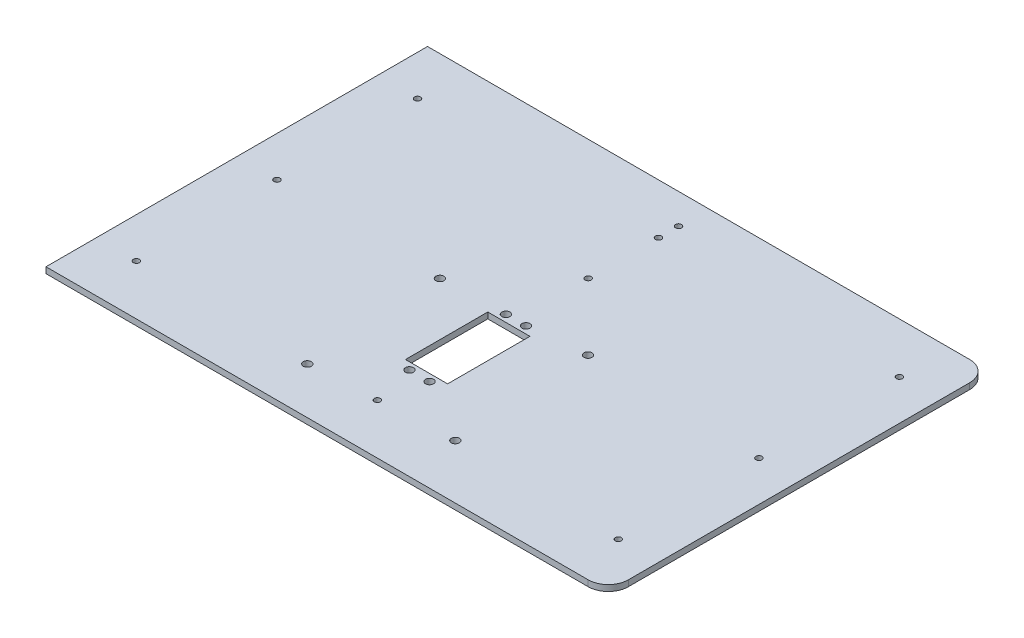
from build123d import *

# Parameters (mm, degrees)
SKETCH_1_W          = 280
SKETCH_1_H          = 190
SKETCH_1_R          = 2
SKETCH_1_W_2        = 21
SKETCH_1_H_2        = 41
EXTRUDE_1_DEPTH     = 3
FILLET_1_R          = 10
SKETCH_2_R          = 1.5
CUT_EXTRUDE_1_DEPTH = 10
SKETCH_3_R          = 1.5
CUT_EXTRUDE_2_DEPTH = 10
SKETCH_4_R          = 1.5
CUT_EXTRUDE_3_DEPTH = 10


with BuildPart() as part:
    # 草图1 → 凸台-拉伸1 (new body)
    with BuildSketch(Plane(origin=(0, 0, 0), x_dir=(1, 0, 0), z_dir=(0, 1, 0))):
        Rectangle(SKETCH_1_W, SKETCH_1_H)
        with Locations(Location((5, -1, 0), (0, 0, 270))):
            Circle(SKETCH_1_R, mode=Mode.SUBTRACT)
        with Locations(Location((-5, -1, 0), (0, 0, 270))):
            Circle(SKETCH_1_R, mode=Mode.SUBTRACT)
        with Locations(Location((-5, -49, 0), (0, 0, 270))):
            Circle(SKETCH_1_R, mode=Mode.SUBTRACT)
        with Locations(Location((-33.028134356, -71.869938174, 0), (0, 0, 270))):
            Circle(SKETCH_1_R, mode=Mode.SUBTRACT)
        with Locations(Location((5, -49, 0), (0, 0, 270))):
            Circle(SKETCH_1_R, mode=Mode.SUBTRACT)
        with Locations(Location((-36.869938174, -1.971865644, 0), (0, 0, 270))):
            Circle(SKETCH_1_R, mode=Mode.SUBTRACT)
        with Locations(Location((33.028134356, 1.869938174, 0), (0, 0, 270))):
            Circle(SKETCH_1_R, mode=Mode.SUBTRACT)
        with Locations(Location((36.869938174, -68.028134356, 0), (0, 0, 270))):
            Circle(SKETCH_1_R, mode=Mode.SUBTRACT)
        with Locations((0, -25)):
            Rectangle(SKETCH_1_W_2, SKETCH_1_H_2, mode=Mode.SUBTRACT)
    extrude(amount=EXTRUDE_1_DEPTH)

    # 圆角1
    fillet_1_edges = [part.edges().sort_by_distance(p)[0] for p in [
        (140, 1.5, 95),
        (140, 1.5, -95),
    ]]
    fillet(fillet_1_edges, radius=FILLET_1_R)

    # 草图2 → 切除-拉伸1 (cut)
    with BuildSketch(Plane(origin=(0, 3, 0), x_dir=(1, 0, 0), z_dir=(0, 1, 0))):
        with Locations(Location((120, -70, 0), (0, 0, 270))):
            Circle(SKETCH_2_R)
        with Locations(Location((0, -70, 0), (0, 0, 270))):
            Circle(SKETCH_2_R)
        with Locations(Location((-120, -70, 0), (0, 0, 270))):
            Circle(SKETCH_2_R)
    cut_extrude_1 = extrude(amount=-CUT_EXTRUDE_1_DEPTH, mode=Mode.SUBTRACT)

    # 镜向1: 切除-拉伸1 across plane
    add(cut_extrude_1.mirror(Plane.XY), mode=Mode.SUBTRACT)

    # 草图3 → 切除-拉伸2 (cut)
    with BuildSketch(Plane(origin=(0, 3, 0), x_dir=(1, 0, 0), z_dir=(0, 1, 0))):
        with Locations(Location((120, 0, 0), (0, 0, 270))):
            Circle(SKETCH_3_R)
        with Locations(Location((-120, 0, 0), (0, 0, 270))):
            Circle(SKETCH_3_R)
    extrude(amount=-CUT_EXTRUDE_2_DEPTH, mode=Mode.SUBTRACT)

    # 草图4 → 切除-拉伸3 (cut)
    with BuildSketch(Plane(origin=(0, 3, 0), x_dir=(1, 0, 0), z_dir=(0, 1, 0))):
        with Locations(Location((0, 80, 0), (0, 0, 270))):
            Circle(SKETCH_4_R)
        with Locations(Location((0, 35, 0), (0, 0, 270))):
            Circle(SKETCH_4_R)
    extrude(amount=-CUT_EXTRUDE_3_DEPTH, mode=Mode.SUBTRACT)


solid = part.part
